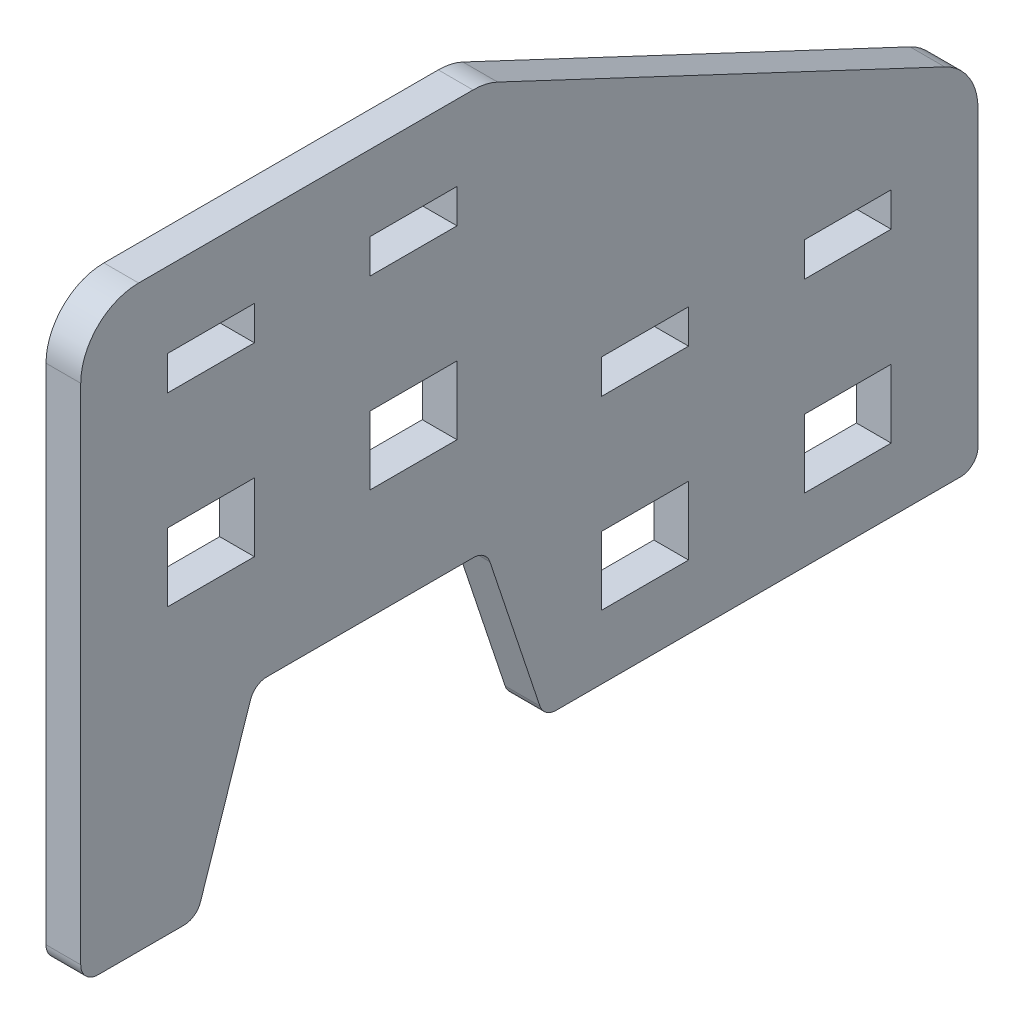
from build123d import *

# Parameters (mm, degrees)
GRUNDFORM_DEPTH          = 6
SKIZZE2_W                = 15
SKIZZE2_H                = 5.9
ZAPFENDURCHBRUCH_DEPTH   = 185.556224495
VERRUNDUNG1_R            = 10
VERRUNDUNG2_R            = 3
SKIZZE3_W                = 15
SKIZZE3_H                = 5.9
ZAPFENDURCHBRUCH_2_DEPTH = 185.556224495


with BuildPart() as part:
    # Skizze1 → Grundform (new body)
    with BuildSketch(Plane(origin=(0, 0, 0), x_dir=(0, 0, -1), z_dir=(1, 0, 0))):
        Polygon((0, 0), (20, 0), (30, 30), (70, 30), (80, 0), (155, 0), (155, 60), (70, 100), (0, 100), align=None)
    extrude(amount=GRUNDFORM_DEPTH)

    # Skizze2 → Zapfendurchbruch (cut, through all)
    with BuildSketch(Plane(origin=(6, 0, 0), x_dir=(0, 0, -1), z_dir=(1, 0, 0))):
        with Locations((97.5, 46)):
            Rectangle(SKIZZE2_W, SKIZZE2_H)
        with Locations((132.5, 46)):
            Rectangle(SKIZZE2_W, SKIZZE2_H)
        with Locations((132.5, 14)):
            Rectangle(SKIZZE2_W, SKIZZE2_H)
        with Locations((97.5, 14)):
            Rectangle(SKIZZE2_W, SKIZZE2_H)
        with Locations((57.5, 84)):
            Rectangle(SKIZZE2_W, SKIZZE2_H)
        with Locations((22.5, 84)):
            Rectangle(SKIZZE2_W, SKIZZE2_H)
        with Locations((22.5, 52)):
            Rectangle(SKIZZE2_W, SKIZZE2_H)
        with Locations((57.5, 52)):
            Rectangle(SKIZZE2_W, SKIZZE2_H)
    extrude(amount=-ZAPFENDURCHBRUCH_DEPTH, mode=Mode.SUBTRACT)

    # Verrundung1
    verrundung1_edges = [part.edges().sort_by_distance(p)[0] for p in [
        (3, 100, 0),
        (3, 100, -70),
        (3, 60, -155),
    ]]
    fillet(verrundung1_edges, radius=VERRUNDUNG1_R)

    # Verrundung2
    verrundung2_edges = [part.edges().sort_by_distance(p)[0] for p in [
        (3, 0, -155),
        (3, 0, -80),
        (3, 30, -70),
        (3, 30, -30),
        (3, 0, -20),
        (3, 0, 0),
    ]]
    fillet(verrundung2_edges, radius=VERRUNDUNG2_R)

    # Skizze3 → Zapfendurchbruch 2 (cut, through all)
    with BuildSketch(Plane.ZY):
        with Locations((-132.5, 19.9)):
            Rectangle(SKIZZE3_W, SKIZZE3_H)
        with Locations((-97.5, 19.9)):
            Rectangle(SKIZZE3_W, SKIZZE3_H)
        with Locations((-57.5, 57.9)):
            Rectangle(SKIZZE3_W, SKIZZE3_H)
        with Locations((-22.5, 57.9)):
            Rectangle(SKIZZE3_W, SKIZZE3_H)
    extrude(amount=-ZAPFENDURCHBRUCH_2_DEPTH, mode=Mode.SUBTRACT)


solid = part.part
